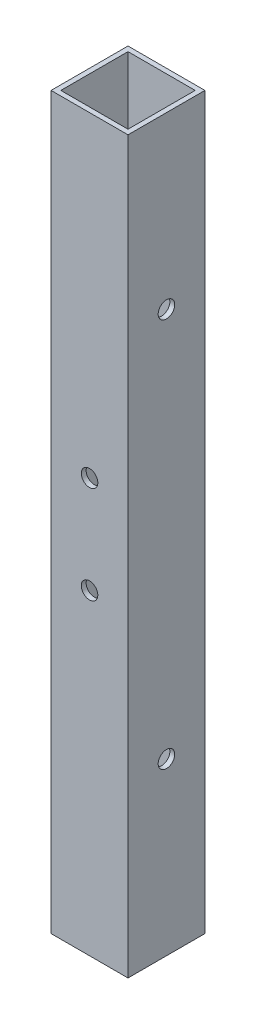
from build123d import *

# Parameters (mm, degrees)
SKETCH1_W           = 15.8
SKETCH1_H           = 15.8
SKETCH1_W_2         = 13.8
SKETCH1_H_2         = 13.8
BOSS_EXTRUDE1_DEPTH = 150
SKETCH2_R           = 1.7
CUT_EXTRUDE1_DEPTH  = 152.036584972
SKETCH3_R           = 1.7
CUT_EXTRUDE3_DEPTH  = 152.036584972


with BuildPart() as part:
    # Sketch1 → Boss-Extrude1 (new body)
    with BuildSketch(Plane(origin=(0, 0, 0), x_dir=(1, 0, 0), z_dir=(0, 1, 0))):
        Rectangle(SKETCH1_W, SKETCH1_H)
        Rectangle(SKETCH1_W_2, SKETCH1_H_2, mode=Mode.SUBTRACT)
    extrude(amount=BOSS_EXTRUDE1_DEPTH)

    # Sketch2 → Cut-Extrude1 (cut, through all)
    with BuildSketch(Plane.ZY.offset(7.9)):
        with Locations((0, 115)):
            Circle(SKETCH2_R)
        with Locations(Location((0, 35, 0), (0, 0, 180))):
            Circle(SKETCH2_R)
    extrude(amount=-CUT_EXTRUDE1_DEPTH, mode=Mode.SUBTRACT)

    # Sketch3 → Cut-Extrude3 (cut, through all)
    with BuildSketch(Plane.XY.offset(7.9)):
        with Locations((0, 85)):
            Circle(SKETCH3_R)
        with Locations((0, 65)):
            Circle(SKETCH3_R)
    extrude(amount=-CUT_EXTRUDE3_DEPTH, mode=Mode.SUBTRACT)


solid = part.part
